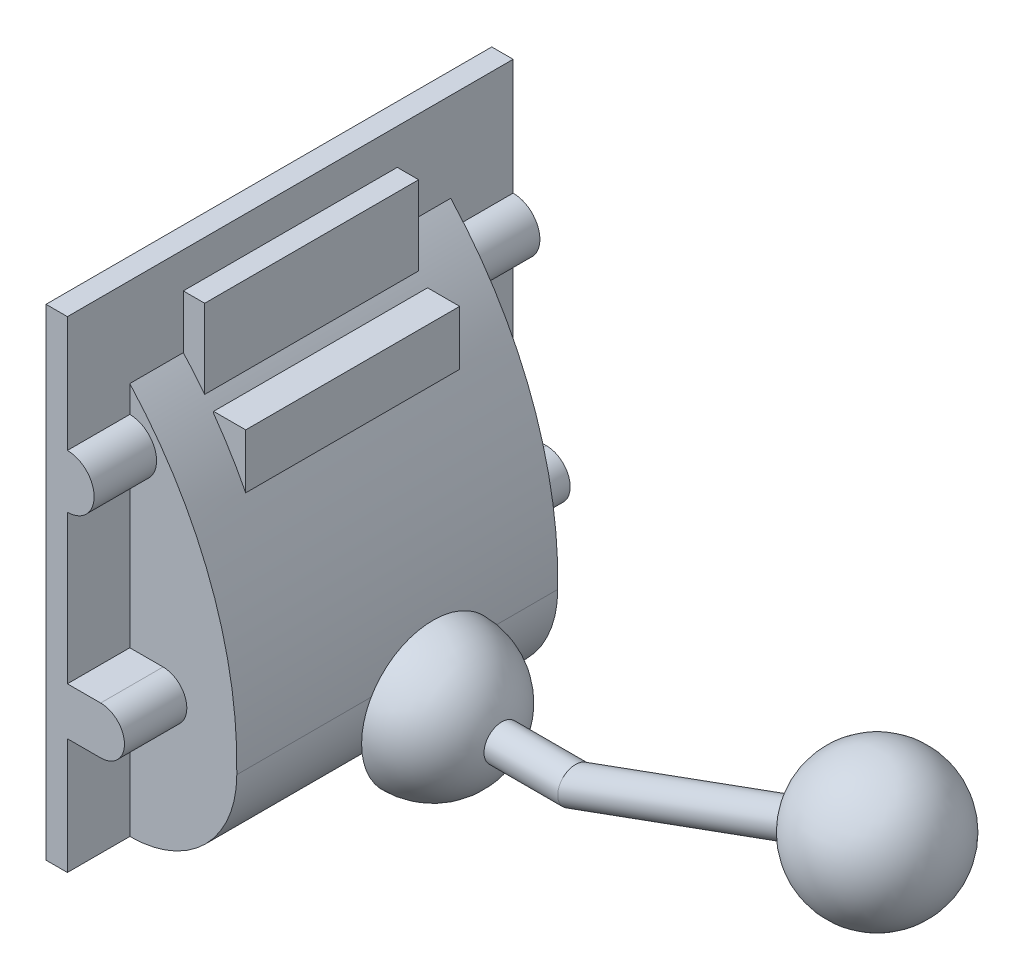
from build123d import *

# Parameters (mm, degrees)
BOSS_EXTRUDE1_DEPTH = 135
SKETCH2_W           = 375
SKETCH2_H           = 405
BOSS_EXTRUDE2_DEPTH = 18
SKETCH3_W           = 18
SKETCH3_H           = 105.613020489
SKETCH3_W_2         = 27
SKETCH3_H_2         = 130.138797092
BOSS_EXTRUDE3_DEPTH = 90
BOSS_EXTRUDE4_REACH = 561.254
SKETCH5_R           = 15
BOSS_EXTRUDE5_DEPTH = 240
SKETCH8_R           = 15


with BuildPart() as part:
    # Sketch1 → Boss-Extrude1 (new, symmetric)
    with BuildSketch(Plane.XY):
        with BuildLine():
            Line((0, 0), (0, 330))
            ThreePointArc((0, 330), (68.115769304, 218.668413489), (90, 90))
            ThreePointArc((90, 90), (63.639610307, 26.360389693), (0, 0))
        make_face()
    extrude(amount=BOSS_EXTRUDE1_DEPTH, both=True)

    # Sketch2 → Boss-Extrude2 (add)
    with BuildSketch(Plane.ZY):
        with Locations((0, 202.5)):
            Rectangle(SKETCH2_W, SKETCH2_H)
    extrude(amount=BOSS_EXTRUDE2_DEPTH)

    # Sketch3 → Boss-Extrude3 (add, symmetric)
    with BuildSketch(Plane.XY):
        with Locations((9, 322.193489755)):
            Rectangle(SKETCH3_W, SKETCH3_H)
        with Locations((39, 234.930601454)):
            Rectangle(SKETCH3_W_2, SKETCH3_H_2)
    extrude(amount=BOSS_EXTRUDE3_DEPTH, both=True)

    # Boss-Extrude4: up to this face of the body (flat: up to its plane)
    boss_extrude4_end = Plane(part.part.faces().sort_by_distance((-9, 202.5, -187.5))[0])
    # Sketch4 → Boss-Extrude4 (add, up to the picked face)
    with BuildSketch(Plane.XY.offset(187.5), mode=Mode.PRIVATE) as boss_extrude4_sk1:
        with BuildLine():
            Line((0, 97.5), (27.982340315, 97.5))
            ThreePointArc((27.982340315, 97.5), (47.982340315, 117.5), (27.982340315, 137.5))
            Line((27.982340315, 137.5), (0, 137.5))
            Line((0, 137.5), (0, 97.5))
        make_face()
    boss_extrude4_tool1 = split(extrude(boss_extrude4_sk1.sketch, amount=-BOSS_EXTRUDE4_REACH, mode=Mode.PRIVATE), bisect_by=boss_extrude4_end, keep=Keep.BOTH, mode=Mode.PRIVATE)
    # Sketch4 → Boss-Extrude4 (add, up to the picked face)
    with BuildSketch(Plane.XY.offset(187.5), mode=Mode.PRIVATE) as boss_extrude4_sk2:
        with BuildLine():
            Line((0, 307.5), (0, 262.5))
            ThreePointArc((0, 262.5), (22.5, 285), (0, 307.5))
        make_face()
    boss_extrude4_tool2 = split(extrude(boss_extrude4_sk2.sketch, amount=-BOSS_EXTRUDE4_REACH, mode=Mode.PRIVATE), bisect_by=boss_extrude4_end, keep=Keep.BOTH, mode=Mode.PRIVATE)
    add(boss_extrude4_tool1.solids().sort_by(Axis((22.073195, 117.5, 187.5), (0, 0, -1)))[0])
    add(boss_extrude4_tool2.solids().sort_by(Axis((9.549297, 285, 187.5), (0, 0, -1)))[0])

    # Sketch5 → Boss-Extrude5 (add)
    with BuildSketch(Plane(origin=(0, 0, 0), x_dir=(0, 0, -1), z_dir=(1, 0, 0))):
        with Locations((0, 90)):
            Circle(SKETCH5_R)
    extrude(amount=BOSS_EXTRUDE5_DEPTH)

    # Sweep1: sweep along a path in Sketch7
    with BuildLine(Plane.XY) as sweep1_path:
        Line((240, 90), (493.717007612, 182.345438698))
    # Sketch8 → Sweep1 (sweep)
    with BuildSketch(Plane(origin=(240, 0, 0), x_dir=(0, 0, -1), z_dir=(1, 0, 0))):
        with Locations((0, 90)):
            Circle(SKETCH8_R)
    sweep(path=sweep1_path.line)


with BuildPart() as body_2:
    # Sketch6 → Revolve1 (revolve)
    with BuildSketch(Plane(origin=(0, 90, 0), x_dir=(-1, 0, 0), z_dir=(0, -1, 0))):
        with BuildLine():
            Line((-120, 0), (-120, -60))
            ThreePointArc((-120, -60), (-162.426406871, -42.426406871), (-180, 0))
            Line((-180, 0), (-120, 0))
        make_face()
    revolve(axis=Axis((120, 90, 0), (1, 0, 0)))


with BuildPart() as body_3:
    # Sketch9 → Revolve2 (revolve)
    with BuildSketch(Plane.XY):
        with BuildLine():
            Line((493.717007612, 122.345438698), (493.717007612, 242.345438698))
            ThreePointArc((493.717007612, 242.345438698), (553.717007612, 182.345438698), (493.717007612, 122.345438698))
        make_face()
    revolve(axis=Axis((493.717007612, 122.345438698, 0), (0, 1, 0)))


solid = Compound([part.part, body_2.part, body_3.part])
